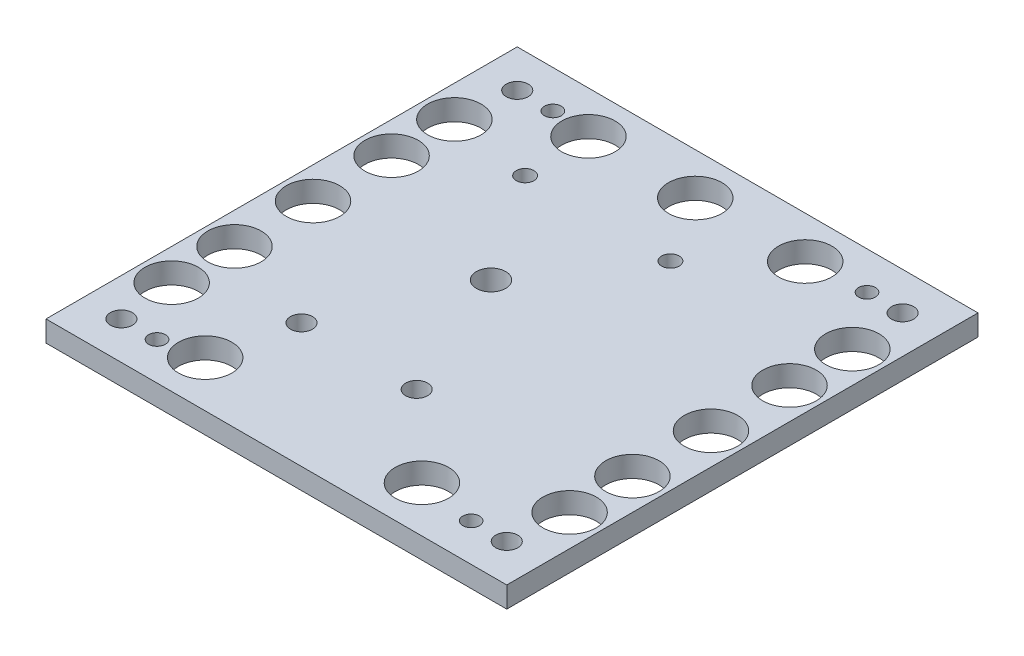
from build123d import *

# Parameters (mm, degrees)
SKETCH1_W             = 220
SKETCH1_H             = 225
BOSS_EXTRUDE1_DEPTH   = 10
CUT_EXTRUDE2_REACH    = 159.659
SKETCH3_R             = 7
F_8_0MM_DOWEL_HOLE1_D = 8
M10_CLEARANCE_HOLE1_D = 10.5
M10_CLEARANCE_HOLE2_D = 10.5
M8_CLEARANCE_HOLE1_D  = 8.4
CUT_EXTRUDE3_REACH    = 231.365
SKETCH17_R            = 12.75


with BuildPart() as part:
    # Sketch1 → Boss-Extrude1 (new body)
    with BuildSketch(Plane(origin=(0, 0, 0), x_dir=(1, 0, 0), z_dir=(0, 1, 0))):
        Rectangle(SKETCH1_W, SKETCH1_H)
    extrude(amount=BOSS_EXTRUDE1_DEPTH)

    # Sketch3 → Cut-Extrude2 (cut, up to next)
    with BuildSketch(Plane.XZ, mode=Mode.PRIVATE) as cut_extrude2_sk1:
        with Locations(Location((-19.87, -9.86, 0), (0, 0, 270))):
            Circle(SKETCH3_R)
    cut_extrude2_tool1 = extrude(cut_extrude2_sk1.sketch, amount=-CUT_EXTRUDE2_REACH, mode=Mode.PRIVATE) & part.part
    add(cut_extrude2_tool1.solids().sort_by_distance((-19.87, 0, -9.86))[0], mode=Mode.SUBTRACT)

    # Ø8.0mm Dowel Hole1 (through all)
    with Locations(Plane(origin=(0, 10, 0), x_dir=(1, 0, 0), z_dir=(0, 1, 0))):
        with Locations((75, -94.5), (-75, -94.5), (75, 94.5), (-75, 94.5)):
            Hole(F_8_0MM_DOWEL_HOLE1_D / 2)

    # M10 Clearance Hole1 (through all)
    with Locations(Plane(origin=(0, 10, 0), x_dir=(1, 0, 0), z_dir=(0, 1, 0))):
        with Locations((92, -94.5), (92, 94.5), (-92, 94.5), (-92, -94.5)):
            Hole(M10_CLEARANCE_HOLE1_D / 2)

    # M10 Clearance Hole2 (through all)
    with Locations(Plane(origin=(0, 10, 0), x_dir=(1, 0, 0), z_dir=(0, 1, 0))):
        with Locations((7.63, -53.14), (-47.37, -53.14)):
            Hole(M10_CLEARANCE_HOLE2_D / 2)

    # M8 Clearance Hole1 (through all)
    with Locations(Plane(origin=(0, 10, 0), x_dir=(1, 0, 0), z_dir=(0, 1, 0))):
        with Locations((15.13, 60.5), (-54.87, 61.13)):
            Hole(M8_CLEARANCE_HOLE1_D / 2)

    # Sketch17 → Cut-Extrude3 (cut, up to next)
    with BuildSketch(Plane(origin=(89.63, 10, 0), x_dir=(1, 0, 0), z_dir=(0, 1, 0)), mode=Mode.PRIVATE) as cut_extrude3_sk1:
        with Locations(Location((-184.63, 0, 0), (0, 0, 270))):
            Circle(SKETCH17_R)
    cut_extrude3_tool1 = extrude(cut_extrude3_sk1.sketch, amount=-CUT_EXTRUDE3_REACH, mode=Mode.PRIVATE) & part.part
    # Sketch17 → Cut-Extrude3 (cut, up to next)
    with BuildSketch(Plane(origin=(89.63, 10, 0), x_dir=(1, 0, 0), z_dir=(0, 1, 0)), mode=Mode.PRIVATE) as cut_extrude3_sk2:
        with Locations(Location((-184.63, -37.5, 0), (0, 0, 270))):
            Circle(SKETCH17_R)
    cut_extrude3_tool2 = extrude(cut_extrude3_sk2.sketch, amount=-CUT_EXTRUDE3_REACH, mode=Mode.PRIVATE) & part.part
    # Sketch17 → Cut-Extrude3 (cut, up to next)
    with BuildSketch(Plane(origin=(89.63, 10, 0), x_dir=(1, 0, 0), z_dir=(0, 1, 0)), mode=Mode.PRIVATE) as cut_extrude3_sk3:
        with Locations(Location((-184.63, -67.5, 0), (0, 0, 270))):
            Circle(SKETCH17_R)
    cut_extrude3_tool3 = extrude(cut_extrude3_sk3.sketch, amount=-CUT_EXTRUDE3_REACH, mode=Mode.PRIVATE) & part.part
    # Sketch17 → Cut-Extrude3 (cut, up to next)
    with BuildSketch(Plane(origin=(89.63, 10, 0), x_dir=(1, 0, 0), z_dir=(0, 1, 0)), mode=Mode.PRIVATE) as cut_extrude3_sk4:
        with Locations(Location((-145.63, -90.5, 0), (0, 0, 270))):
            Circle(SKETCH17_R)
    cut_extrude3_tool4 = extrude(cut_extrude3_sk4.sketch, amount=-CUT_EXTRUDE3_REACH, mode=Mode.PRIVATE) & part.part
    # Sketch17 → Cut-Extrude3 (cut, up to next)
    with BuildSketch(Plane(origin=(89.63, 10, 0), x_dir=(1, 0, 0), z_dir=(0, 1, 0)), mode=Mode.PRIVATE) as cut_extrude3_sk5:
        with Locations(Location((-42.13, -90.5, 0), (0, 0, 270))):
            Circle(SKETCH17_R)
    cut_extrude3_tool5 = extrude(cut_extrude3_sk5.sketch, amount=-CUT_EXTRUDE3_REACH, mode=Mode.PRIVATE) & part.part
    # Sketch17 → Cut-Extrude3 (cut, up to next)
    with BuildSketch(Plane(origin=(89.63, 10, 0), x_dir=(1, 0, 0), z_dir=(0, 1, 0)), mode=Mode.PRIVATE) as cut_extrude3_sk6:
        with Locations(Location((5.37, -67.5, 0), (0, 0, 270))):
            Circle(SKETCH17_R)
    cut_extrude3_tool6 = extrude(cut_extrude3_sk6.sketch, amount=-CUT_EXTRUDE3_REACH, mode=Mode.PRIVATE) & part.part
    # Sketch17 → Cut-Extrude3 (cut, up to next)
    with BuildSketch(Plane(origin=(89.63, 10, 0), x_dir=(1, 0, 0), z_dir=(0, 1, 0)), mode=Mode.PRIVATE) as cut_extrude3_sk7:
        with Locations(Location((5.37, -37.5, 0), (0, 0, 270))):
            Circle(SKETCH17_R)
    cut_extrude3_tool7 = extrude(cut_extrude3_sk7.sketch, amount=-CUT_EXTRUDE3_REACH, mode=Mode.PRIVATE) & part.part
    # Sketch17 → Cut-Extrude3 (cut, up to next)
    with BuildSketch(Plane(origin=(89.63, 10, 0), x_dir=(1, 0, 0), z_dir=(0, 1, 0)), mode=Mode.PRIVATE) as cut_extrude3_sk8:
        with Locations(Location((5.37, 0, 0), (0, 0, 270))):
            Circle(SKETCH17_R)
    cut_extrude3_tool8 = extrude(cut_extrude3_sk8.sketch, amount=-CUT_EXTRUDE3_REACH, mode=Mode.PRIVATE) & part.part
    # Sketch17 → Cut-Extrude3 (cut, up to next)
    with BuildSketch(Plane(origin=(89.63, 10, 0), x_dir=(1, 0, 0), z_dir=(0, 1, 0)), mode=Mode.PRIVATE) as cut_extrude3_sk9:
        with Locations(Location((-184.63, 37.5, 0), (0, 0, 270))):
            Circle(SKETCH17_R)
    cut_extrude3_tool9 = extrude(cut_extrude3_sk9.sketch, amount=-CUT_EXTRUDE3_REACH, mode=Mode.PRIVATE) & part.part
    # Sketch17 → Cut-Extrude3 (cut, up to next)
    with BuildSketch(Plane(origin=(89.63, 10, 0), x_dir=(1, 0, 0), z_dir=(0, 1, 0)), mode=Mode.PRIVATE) as cut_extrude3_sk10:
        with Locations(Location((-184.63, 67.5, 0), (0, 0, 270))):
            Circle(SKETCH17_R)
    cut_extrude3_tool10 = extrude(cut_extrude3_sk10.sketch, amount=-CUT_EXTRUDE3_REACH, mode=Mode.PRIVATE) & part.part
    # Sketch17 → Cut-Extrude3 (cut, up to next)
    with BuildSketch(Plane(origin=(89.63, 10, 0), x_dir=(1, 0, 0), z_dir=(0, 1, 0)), mode=Mode.PRIVATE) as cut_extrude3_sk11:
        with Locations(Location((5.37, 37.5, 0), (0, 0, 270))):
            Circle(SKETCH17_R)
    cut_extrude3_tool11 = extrude(cut_extrude3_sk11.sketch, amount=-CUT_EXTRUDE3_REACH, mode=Mode.PRIVATE) & part.part
    # Sketch17 → Cut-Extrude3 (cut, up to next)
    with BuildSketch(Plane(origin=(89.63, 10, 0), x_dir=(1, 0, 0), z_dir=(0, 1, 0)), mode=Mode.PRIVATE) as cut_extrude3_sk12:
        with Locations(Location((5.37, 67.5, 0), (0, 0, 270))):
            Circle(SKETCH17_R)
    cut_extrude3_tool12 = extrude(cut_extrude3_sk12.sketch, amount=-CUT_EXTRUDE3_REACH, mode=Mode.PRIVATE) & part.part
    # Sketch17 → Cut-Extrude3 (cut, up to next)
    with BuildSketch(Plane(origin=(89.63, 10, 0), x_dir=(1, 0, 0), z_dir=(0, 1, 0)), mode=Mode.PRIVATE) as cut_extrude3_sk13:
        with Locations(Location((-42.13, 92.5, 0), (0, 0, 270))):
            Circle(SKETCH17_R)
    cut_extrude3_tool13 = extrude(cut_extrude3_sk13.sketch, amount=-CUT_EXTRUDE3_REACH, mode=Mode.PRIVATE) & part.part
    # Sketch17 → Cut-Extrude3 (cut, up to next)
    with BuildSketch(Plane(origin=(89.63, 10, 0), x_dir=(1, 0, 0), z_dir=(0, 1, 0)), mode=Mode.PRIVATE) as cut_extrude3_sk14:
        with Locations(Location((-94.63, 92.5, 0), (0, 0, 270))):
            Circle(SKETCH17_R)
    cut_extrude3_tool14 = extrude(cut_extrude3_sk14.sketch, amount=-CUT_EXTRUDE3_REACH, mode=Mode.PRIVATE) & part.part
    # Sketch17 → Cut-Extrude3 (cut, up to next)
    with BuildSketch(Plane(origin=(89.63, 10, 0), x_dir=(1, 0, 0), z_dir=(0, 1, 0)), mode=Mode.PRIVATE) as cut_extrude3_sk15:
        with Locations(Location((-145.63, 92.5, 0), (0, 0, 270))):
            Circle(SKETCH17_R)
    cut_extrude3_tool15 = extrude(cut_extrude3_sk15.sketch, amount=-CUT_EXTRUDE3_REACH, mode=Mode.PRIVATE) & part.part
    add(cut_extrude3_tool1.solids().sort_by_distance((-95, 10, 0))[0], mode=Mode.SUBTRACT)
    add(cut_extrude3_tool2.solids().sort_by_distance((-95, 10, 37.5))[0], mode=Mode.SUBTRACT)
    add(cut_extrude3_tool3.solids().sort_by_distance((-95, 10, 67.5))[0], mode=Mode.SUBTRACT)
    add(cut_extrude3_tool4.solids().sort_by_distance((-56, 10, 90.5))[0], mode=Mode.SUBTRACT)
    add(cut_extrude3_tool5.solids().sort_by_distance((47.5, 10, 90.5))[0], mode=Mode.SUBTRACT)
    add(cut_extrude3_tool6.solids().sort_by_distance((95, 10, 67.5))[0], mode=Mode.SUBTRACT)
    add(cut_extrude3_tool7.solids().sort_by_distance((95, 10, 37.5))[0], mode=Mode.SUBTRACT)
    add(cut_extrude3_tool8.solids().sort_by_distance((95, 10, 0))[0], mode=Mode.SUBTRACT)
    add(cut_extrude3_tool9.solids().sort_by_distance((-95, 10, -37.5))[0], mode=Mode.SUBTRACT)
    add(cut_extrude3_tool10.solids().sort_by_distance((-95, 10, -67.5))[0], mode=Mode.SUBTRACT)
    add(cut_extrude3_tool11.solids().sort_by_distance((95, 10, -37.5))[0], mode=Mode.SUBTRACT)
    add(cut_extrude3_tool12.solids().sort_by_distance((95, 10, -67.5))[0], mode=Mode.SUBTRACT)
    add(cut_extrude3_tool13.solids().sort_by_distance((47.5, 10, -92.5))[0], mode=Mode.SUBTRACT)
    add(cut_extrude3_tool14.solids().sort_by_distance((-5, 10, -92.5))[0], mode=Mode.SUBTRACT)
    add(cut_extrude3_tool15.solids().sort_by_distance((-56, 10, -92.5))[0], mode=Mode.SUBTRACT)


solid = part.part
